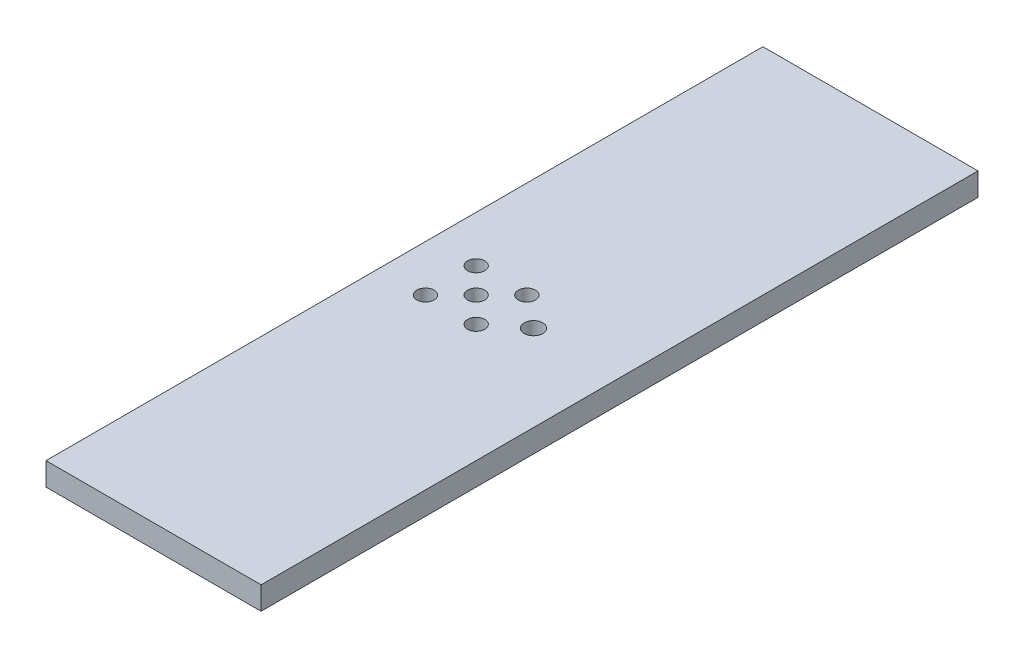
from build123d import *

# Parameters (mm, degrees)
SKETCH1_W                = 15
SKETCH1_H                = 50
BOSS_EXTRUDE1_DEPTH      = 1.6
M12_MOUNTING_HOLES_REACH = 31.199
SKETCH3_R                = 0.6
SKETCH3_R_2              = 0.65


with BuildPart() as part:
    # Sketch1 → Boss-Extrude1 (new body)
    with BuildSketch(Plane(origin=(0, 0, 0), x_dir=(1, 0, 0), z_dir=(0, 1, 0))):
        with Locations((7.5, 0)):
            Rectangle(SKETCH1_W, SKETCH1_H)
    extrude(amount=BOSS_EXTRUDE1_DEPTH)

    # Sketch3 → M12 mounting holes (cut, up to next)
    with BuildSketch(Plane(origin=(0, 1.6, 0), x_dir=(1, 0, 0), z_dir=(0, 1, 0)), mode=Mode.PRIVATE) as m12_mounting_holes_sk1:
        with Locations(Location((5, 0, 0), (0, 0, 270))):
            Circle(SKETCH3_R)
    m12_mounting_holes_tool1 = extrude(m12_mounting_holes_sk1.sketch, amount=-M12_MOUNTING_HOLES_REACH, mode=Mode.PRIVATE) & part.part
    # Sketch3 → M12 mounting holes (cut, up to next)
    with BuildSketch(Plane(origin=(0, 1.6, 0), x_dir=(1, 0, 0), z_dir=(0, 1, 0)), mode=Mode.PRIVATE) as m12_mounting_holes_sk2:
        with Locations(Location((3.232233047, 1.767766953, 0), (0, 0, 270))):
            Circle(SKETCH3_R)
    m12_mounting_holes_tool2 = extrude(m12_mounting_holes_sk2.sketch, amount=-M12_MOUNTING_HOLES_REACH, mode=Mode.PRIVATE) & part.part
    # Sketch3 → M12 mounting holes (cut, up to next)
    with BuildSketch(Plane(origin=(0, 1.6, 0), x_dir=(1, 0, 0), z_dir=(0, 1, 0)), mode=Mode.PRIVATE) as m12_mounting_holes_sk3:
        with Locations(Location((6.767766953, 1.767766953, 0), (0, 0, 270))):
            Circle(SKETCH3_R)
    m12_mounting_holes_tool3 = extrude(m12_mounting_holes_sk3.sketch, amount=-M12_MOUNTING_HOLES_REACH, mode=Mode.PRIVATE) & part.part
    # Sketch3 → M12 mounting holes (cut, up to next)
    with BuildSketch(Plane(origin=(0, 1.6, 0), x_dir=(1, 0, 0), z_dir=(0, 1, 0)), mode=Mode.PRIVATE) as m12_mounting_holes_sk4:
        with Locations(Location((6.767766953, -1.767766953, 0), (0, 0, 270))):
            Circle(SKETCH3_R)
    m12_mounting_holes_tool4 = extrude(m12_mounting_holes_sk4.sketch, amount=-M12_MOUNTING_HOLES_REACH, mode=Mode.PRIVATE) & part.part
    # Sketch3 → M12 mounting holes (cut, up to next)
    with BuildSketch(Plane(origin=(0, 1.6, 0), x_dir=(1, 0, 0), z_dir=(0, 1, 0)), mode=Mode.PRIVATE) as m12_mounting_holes_sk5:
        with Locations(Location((3.232233047, -1.767766953, 0), (0, 0, 270))):
            Circle(SKETCH3_R)
    m12_mounting_holes_tool5 = extrude(m12_mounting_holes_sk5.sketch, amount=-M12_MOUNTING_HOLES_REACH, mode=Mode.PRIVATE) & part.part
    # Sketch3 → M12 mounting holes (cut, up to next)
    with BuildSketch(Plane(origin=(0, 1.6, 0), x_dir=(1, 0, 0), z_dir=(0, 1, 0)), mode=Mode.PRIVATE) as m12_mounting_holes_sk6:
        with Locations(Location((9, 0, 0), (0, 0, 270))):
            Circle(SKETCH3_R_2)
    m12_mounting_holes_tool6 = extrude(m12_mounting_holes_sk6.sketch, amount=-M12_MOUNTING_HOLES_REACH, mode=Mode.PRIVATE) & part.part
    add(m12_mounting_holes_tool1.solids().sort_by_distance((5, 1.6, 0))[0], mode=Mode.SUBTRACT)
    add(m12_mounting_holes_tool2.solids().sort_by_distance((3.232233, 1.6, -1.767767))[0], mode=Mode.SUBTRACT)
    add(m12_mounting_holes_tool3.solids().sort_by_distance((6.767767, 1.6, -1.767767))[0], mode=Mode.SUBTRACT)
    add(m12_mounting_holes_tool4.solids().sort_by_distance((6.767767, 1.6, 1.767767))[0], mode=Mode.SUBTRACT)
    add(m12_mounting_holes_tool5.solids().sort_by_distance((3.232233, 1.6, 1.767767))[0], mode=Mode.SUBTRACT)
    add(m12_mounting_holes_tool6.solids().sort_by_distance((9, 1.6, 0))[0], mode=Mode.SUBTRACT)


solid = part.part
